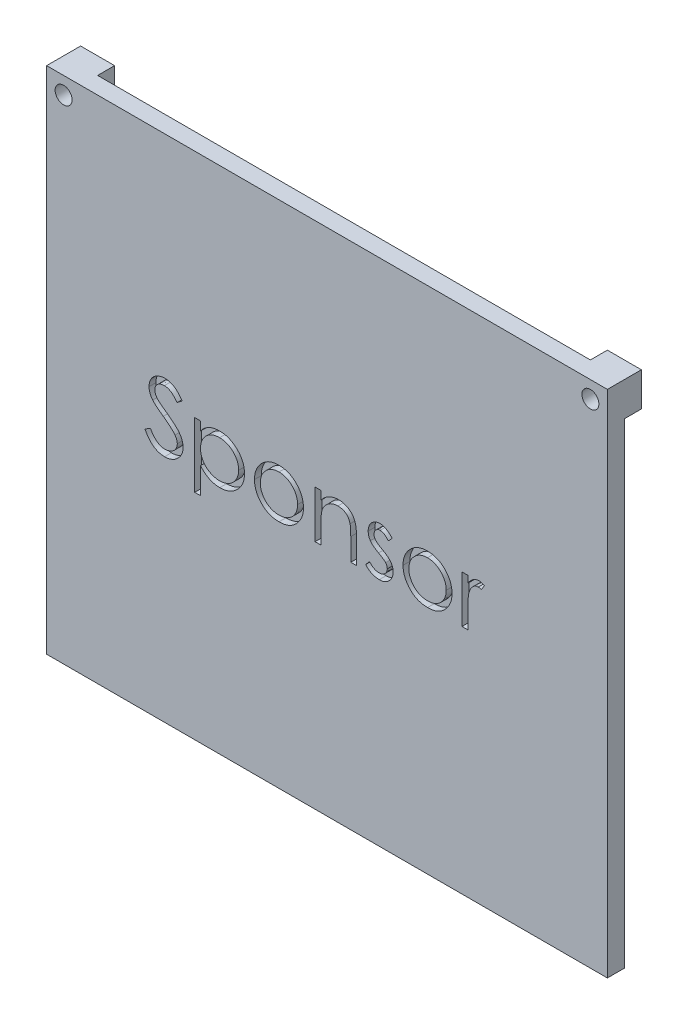
from build123d import *

# Parameters (mm, degrees)
ESQUISSE1_W             = 165
ESQUISSE1_H             = 150
BASE_DEPTH              = 5
ESQUISSE2_W             = 10
ESQUISSE2_H             = 5
BOSS_TIGE_DEPTH         = 10
ESQUISSE3_R             = 2.5
VIDE_VIS_DEPTH          = 112.943065886
ENL_V_MAT_EXTRU_2_DEPTH = 2


with BuildPart() as part:
    # Esquisse1 → BASE (new body)
    with BuildSketch(Plane.XY):
        Rectangle(ESQUISSE1_W, ESQUISSE1_H)
    extrude(amount=BASE_DEPTH)

    # Esquisse2 → BOSS - TIGE (add)
    with BuildSketch(Plane(origin=(0, 75, 0), x_dir=(1, 0, 0), z_dir=(0, 1, 0))):
        with Locations((-77.5, 2.5)):
            Rectangle(ESQUISSE2_W, ESQUISSE2_H)
        with Locations((77.5, 2.5)):
            Rectangle(ESQUISSE2_W, ESQUISSE2_H)
    extrude(amount=-BOSS_TIGE_DEPTH)

    # Esquisse3 → VIDE VIS (cut, through all)
    with BuildSketch(Plane(origin=(0, 0, -5), x_dir=(-1, 0, 0), z_dir=(0, 0, -1))):
        with Locations((-77.5, 70)):
            Circle(ESQUISSE3_R)
        with Locations(Location((77.5, 70, 0), (0, 0, 180))):
            Circle(ESQUISSE3_R)
    extrude(amount=-VIDE_VIS_DEPTH, mode=Mode.SUBTRACT)

    # Esquisse4 → Enlèv. mat.-Extru.2 (cut)
    # profile 1 of 7: a face of its own
    with BuildSketch(Plane.XY.offset(5)):
        with BuildLine():
            Line((-53.580330307, -3.143127408), (-51.969933672, -2.177652648))
            add(Edge.make_bspline(
                [(-51.969933672, -2.177652648), (-51.820155838, -2.428374515), (-51.533187288, -2.908747936), (-51.054480604, -3.557852413), (-50.558457188, -4.109552152), (-50.041443815, -4.560637687), (-49.506596297, -4.915778057), (-48.950423091, -5.167250203), (-48.374798435, -5.324091441), (-47.983055207, -5.343141912), (-47.787481749, -5.352652648)],
                knots=[0, 0, 0, 0, 1.272034388, 2.437168799, 3.508375237, 4.49857839, 5.41946034, 6.295179144, 7.148887113, 8, 8, 8, 8], degree=3))
            add(Edge.make_bspline(
                [(-47.787481749, -5.352652648), (-47.620457551, -5.348000788), (-47.289331686, -5.338778464), (-46.801857192, -5.250164384), (-46.328427669, -5.114026939), (-45.878800655, -4.919058726), (-45.459180239, -4.68317354), (-45.091206654, -4.398260774), (-44.773092809, -4.079275568), (-44.512874629, -3.723407119), (-44.313230437, -3.340680925), (-44.159785036, -2.947837533), (-44.074631135, -2.538705754), (-44.061803662, -2.263240235), (-44.055330307, -2.124227167)],
                knots=[0, 0, 0, 0, 1.095163259, 2.171163733, 3.241058638, 4.321873601, 5.38011039, 6.391990106, 7.366004449, 8.327778327, 9.272591725, 10.192022065, 11.087607919, 12, 12, 12, 12], degree=3))
            add(Edge.make_bspline(
                [(-44.055330307, -2.124227167), (-44.063354769, -1.965617685), (-44.079667329, -1.643187786), (-44.217542956, -1.167483961), (-44.434436714, -0.696717258), (-44.634530532, -0.405517512), (-44.738413239, -0.25433534)],
                knots=[0, 0, 0, 0, 0.938893495, 1.908633276, 2.914225137, 4, 4, 4, 4], degree=3))
            add(Edge.make_bspline(
                [(-44.738413239, -0.25433534), (-44.823706154, -0.145223343), (-45.002767958, 0.083843646), (-45.31060242, 0.424812713), (-45.671823699, 0.776521536), (-46.074070191, 1.152400118), (-46.531994574, 1.534966554), (-47.031254331, 1.942463895), (-47.584596192, 2.359395336), (-47.972669167, 2.639008872), (-48.172908432, 2.783284852)],
                knots=[0, 0, 0, 0, 0.722233717, 1.516239348, 2.393582979, 3.351407094, 4.387010283, 5.505090956, 6.712668013, 8, 8, 8, 8], degree=3))
            add(Edge.make_bspline(
                [(-48.172908432, 2.783284852), (-48.373336182, 2.926043307), (-48.756538779, 3.198986603), (-49.292434777, 3.604067349), (-49.771648212, 3.97442041), (-50.192049144, 4.313532248), (-50.553452664, 4.621448854), (-50.858706659, 4.895213351), (-51.100035091, 5.142229589), (-51.234231894, 5.302474606), (-51.294482951, 5.374420669)],
                knots=[0, 0, 0, 0, 1.452282411, 2.77665338, 3.964542531, 5.026858415, 5.96415736, 6.766646006, 7.446254459, 8, 8, 8, 8], degree=3))
            add(Edge.make_bspline(
                [(-51.294482951, 5.374420669), (-51.378697804, 5.48654917), (-51.544317615, 5.707064915), (-51.762935445, 6.051733069), (-51.948750031, 6.404556842), (-52.094413582, 6.766484334), (-52.217075002, 7.132434446), (-52.299577453, 7.507181941), (-52.351237771, 7.889045279), (-52.356528154, 8.146021618), (-52.35917646, 8.274661054)],
                knots=[0, 0, 0, 0, 1.068054152, 2.10047183, 3.106115577, 4.101338837, 5.06977816, 6.043150881, 7.020423561, 8, 8, 8, 8], degree=3))
            add(Edge.make_bspline(
                [(-52.35917646, 8.274661054), (-52.352072394, 8.476208827), (-52.338016107, 8.874996431), (-52.219141291, 9.457549951), (-52.031510256, 10.013736022), (-51.76864808, 10.538048267), (-51.429790202, 11.016834534), (-51.037654256, 11.455602227), (-50.570594595, 11.824456939), (-50.058135317, 12.146739714), (-49.497214206, 12.398993964), (-48.909435146, 12.589281585), (-48.29386394, 12.697100545), (-47.876924022, 12.712573308), (-47.665366364, 12.720424275)],
                knots=[0, 0, 0, 0, 1.005424448, 1.989358655, 2.955360095, 3.929531133, 4.905563448, 5.876582895, 6.856512386, 7.866279853, 8.892233794, 9.918561126, 10.94386622, 12, 12, 12, 12], degree=3))
            add(Edge.make_bspline(
                [(-47.665366364, 12.720424275), (-47.440880618, 12.71268153), (-46.994450118, 12.697283681), (-46.337773673, 12.563402832), (-45.705527488, 12.34187489), (-45.196929147, 12.090476623), (-44.798877974, 11.839389917), (-44.495314958, 11.610682017), (-44.187698547, 11.347383211), (-43.87354742, 11.048792172), (-43.558184688, 10.712169141), (-43.236928469, 10.339819534), (-42.90902752, 9.934018851), (-42.69808491, 9.644325497), (-42.589945691, 9.4958149)],
                knots=[0, 0, 0, 0, 1.286793592, 2.559021753, 3.825965368, 5.121522368, 5.803751409, 6.523245864, 7.299691795, 8.125521123, 9.008227632, 9.944561021, 10.946284179, 12, 12, 12, 12], degree=3))
            Line((-42.589945691, 9.4958149), (-44.135468528, 8.324270429))
            add(Edge.make_bspline(
                [(-44.135468528, 8.324270429), (-44.228791389, 8.444496015), (-44.408509399, 8.676022385), (-44.681357035, 9.000260546), (-44.938524676, 9.29644167), (-45.191891852, 9.55369901), (-45.428077189, 9.786120621), (-45.657314233, 9.985110155), (-45.876304059, 10.152617324), (-46.152348958, 10.331380129), (-46.499155397, 10.508580527), (-46.934499801, 10.658526223), (-47.389447955, 10.74863306), (-47.699307807, 10.760546863), (-47.856171653, 10.766578121)],
                knots=[0, 0, 0, 0, 1.181633172, 2.275549214, 3.290209073, 4.226197932, 5.078386478, 5.862611352, 6.581680152, 7.217281963, 8.414376989, 9.595101626, 10.782541182, 12, 12, 12, 12], degree=3))
            add(Edge.make_bspline(
                [(-47.856171653, 10.766578121), (-48.052966439, 10.759983011), (-48.432466646, 10.747264963), (-48.971256359, 10.608363329), (-49.456181866, 10.389659204), (-49.872846541, 10.083144823), (-50.219757802, 9.719991991), (-50.470703228, 9.302095652), (-50.621743409, 8.840637146), (-50.640174445, 8.51873756), (-50.649561076, 8.354799275)],
                knots=[0, 0, 0, 0, 1.14458467, 2.207223713, 3.21896685, 4.227309161, 5.202851033, 6.127160689, 7.046193047, 8, 8, 8, 8], degree=3))
            add(Edge.make_bspline(
                [(-50.649561076, 8.354799275), (-50.647421344, 8.252737656), (-50.643138381, 8.048447527), (-50.583404125, 7.746633359), (-50.506663491, 7.44558164), (-50.385055739, 7.146645868), (-50.217169157, 6.844598), (-49.996705271, 6.534236828), (-49.719047102, 6.212826814), (-49.506356506, 6.003780965), (-49.394062278, 5.893411054)],
                knots=[0, 0, 0, 0, 0.858281714, 1.717966888, 2.583508476, 3.4729293, 4.427298488, 5.488583878, 6.674047936, 8, 8, 8, 8], degree=3))
            add(Edge.make_bspline(
                [(-49.394062278, 5.893411054), (-49.352362522, 5.856198099), (-49.253293448, 5.767788636), (-49.072177338, 5.623050652), (-48.833002965, 5.444509848), (-48.542015841, 5.223598883), (-48.19385063, 4.967341211), (-47.788469046, 4.679013407), (-47.330389845, 4.349255409), (-47.005331989, 4.118709366), (-46.833455307, 3.996806486)],
                knots=[0, 0, 0, 0, 0.420754252, 0.999615792, 1.744751191, 2.668019286, 3.750313428, 4.999500688, 6.413464383, 8, 8, 8, 8], degree=3))
            add(Edge.make_bspline(
                [(-46.833455307, 3.996806486), (-46.626703407, 3.846358515), (-46.226357009, 3.555036871), (-45.656720752, 3.117345812), (-45.140227311, 2.689277243), (-44.675063303, 2.273564839), (-44.256633273, 1.873361933), (-43.889579393, 1.483853765), (-43.570161619, 1.107830863), (-43.226286158, 0.625742986), (-42.874907169, 0.033663085), (-42.573146965, -0.691751328), (-42.382873673, -1.419985587), (-42.357991568, -1.909444511), (-42.345714922, -2.150939908)],
                knots=[0, 0, 0, 0, 1.163667725, 2.253281268, 3.268753668, 4.215851969, 5.092017293, 5.902905408, 6.650798638, 7.335211899, 8.59617414, 9.77448103, 10.901945474, 12, 12, 12, 12], degree=3))
            add(Edge.make_bspline(
                [(-42.345714922, -2.150939908), (-42.349291631, -2.321727866), (-42.356375592, -2.659987197), (-42.437805708, -3.156675544), (-42.557111314, -3.639080706), (-42.736928259, -4.101239761), (-42.956401449, -4.551607683), (-43.234892026, -4.978370684), (-43.557695282, -5.390974082), (-43.927993345, -5.778415657), (-44.333191756, -6.134085666), (-44.761455866, -6.450473844), (-45.213486637, -6.714280004), (-45.686831875, -6.929549587), (-46.181600308, -7.097916304), (-46.697625531, -7.219906349), (-47.235758157, -7.294776718), (-47.601520778, -7.30254782), (-47.787481749, -7.306498802)],
                knots=[0, 0, 0, 0, 0.983748083, 1.948392443, 2.894712957, 3.844097841, 4.80183111, 5.778335162, 6.776009319, 7.81870978, 8.863265674, 9.881300176, 10.883814829, 11.87499822, 12.874611388, 13.892143829, 14.928324115, 16, 16, 16, 16], degree=3))
            add(Edge.make_bspline(
                [(-47.787481749, -7.306498802), (-47.931365544, -7.303716514), (-48.217321067, -7.298186977), (-48.640282675, -7.249303151), (-49.054699582, -7.180140201), (-49.455371603, -7.07033562), (-49.847460944, -6.937110931), (-50.22926232, -6.773072292), (-50.60096077, -6.576491524), (-50.964639329, -6.351728604), (-51.31937305, -6.090157166), (-51.661834726, -5.785501421), (-52.003260721, -5.446163744), (-52.33357355, -5.062929106), (-52.659454521, -4.64198897), (-52.974478436, -4.179404986), (-53.28516607, -3.677696817), (-53.480104545, -3.324645422), (-53.580330307, -3.143127408)],
                knots=[0, 0, 0, 0, 0.915332311, 1.819136955, 2.706846663, 3.586547465, 4.459518054, 5.340707479, 6.227863349, 7.133153174, 8.059268498, 9.028702269, 10.047606654, 11.120612155, 12.245963614, 13.433783089, 14.680604001, 16, 16, 16, 16], degree=3))
        make_face()
    # profile 2 of 7: a face of its own
    with BuildSketch(Plane.XY.offset(5)):
        with BuildLine():
            Line((-38.926484153, 7.103116583), (-37.216868768, 7.103116583))
            Line((-37.216868768, 7.103116583), (-37.216868768, 4.527245188))
            add(Edge.make_bspline(
                [(-37.216868768, 4.527245188), (-37.035308748, 4.76094914), (-36.682483182, 5.215106), (-36.074380486, 5.802880842), (-35.432521712, 6.298590709), (-34.740389424, 6.687115639), (-34.008740482, 6.980054629), (-33.24057744, 7.196568492), (-32.429380734, 7.32415709), (-31.874772899, 7.339514989), (-31.591928864, 7.347347352)],
                knots=[0, 0, 0, 0, 1.0828784, 2.104357462, 3.088488658, 4.04616522, 5.001424249, 5.969181776, 6.964304535, 8, 8, 8, 8], degree=3))
            add(Edge.make_bspline(
                [(-31.591928864, 7.347347352), (-31.344868853, 7.340199907), (-30.856541761, 7.326072606), (-30.137740472, 7.23042498), (-29.445543027, 7.066498683), (-28.783865476, 6.830273701), (-28.145619364, 6.538234643), (-27.540253364, 6.169660492), (-26.958338154, 5.742906797), (-26.41450861, 5.25178609), (-25.912016596, 4.720409383), (-25.477425238, 4.148787985), (-25.102565302, 3.555720193), (-24.799559831, 2.932011805), (-24.562205826, 2.282574283), (-24.393397366, 1.604783769), (-24.29293505, 0.901153293), (-24.279456077, 0.422711342), (-24.272637999, 0.180700717)],
                knots=[0, 0, 0, 0, 1.041296284, 2.058176809, 3.050446431, 4.034000596, 5.01514041, 6.003636468, 7.015969324, 8.052561599, 9.08815499, 10.094063707, 11.074456064, 12.040834395, 13.011057502, 13.983766392, 14.980127149, 16, 16, 16, 16], degree=3))
            add(Edge.make_bspline(
                [(-24.272637999, 0.180700717), (-24.279308142, -0.066417562), (-24.292462626, -0.553770471), (-24.394489016, -1.269435957), (-24.557540002, -1.957888663), (-24.791899541, -2.617983484), (-25.094748214, -3.249265929), (-25.463254464, -3.851280741), (-25.898065092, -4.42383504), (-26.395004087, -4.959155825), (-26.934135067, -5.452274942), (-27.510411117, -5.883556435), (-28.114888984, -6.245731635), (-28.744476065, -6.548261744), (-29.40456204, -6.776274917), (-30.092067166, -6.940746089), (-30.806617135, -7.042170987), (-31.292670548, -7.055517648), (-31.538503384, -7.062268033)],
                knots=[0, 0, 0, 0, 1.038740735, 2.04854663, 3.033179607, 4.009277356, 4.987731542, 5.972001279, 6.972200261, 8.005528982, 9.039189865, 10.040446548, 11.026516639, 11.997840187, 12.972163198, 13.956796175, 14.96660207, 16, 16, 16, 16], degree=3))
            add(Edge.make_bspline(
                [(-31.538503384, -7.062268033), (-31.815150597, -7.055220579), (-32.361609949, -7.041299793), (-33.160608698, -6.900224147), (-33.92955842, -6.68938454), (-34.659939909, -6.380780017), (-35.357539003, -5.987503566), (-36.01840966, -5.507932303), (-36.646062272, -4.943069188), (-37.023844223, -4.51454316), (-37.216868768, -4.29559135)],
                knots=[0, 0, 0, 0, 1.014726462, 2.004382257, 2.969841629, 3.936926163, 4.907207904, 5.903978561, 6.929055279, 8, 8, 8, 8], degree=3))
            Line((-37.216868768, -4.29559135), (-37.216868768, -11.946883417))
            Line((-37.216868768, -11.946883417), (-38.926484153, -11.946883417))
            Line((-38.926484153, -11.946883417), (-38.926484153, 7.103116583))
        make_face()
        with BuildLine():
            add(Edge.make_bspline(
                [(-31.607193287, 5.637731967), (-31.800847763, 5.634247133), (-32.182103511, 5.627386393), (-32.740933731, 5.545885329), (-33.279207417, 5.427569909), (-33.791499752, 5.248435138), (-34.282720965, 5.028550169), (-34.749087633, 4.753783794), (-35.190272394, 4.429106448), (-35.60516523, 4.060737447), (-35.979978299, 3.654838073), (-36.311790807, 3.221652998), (-36.590504853, 2.76173081), (-36.821837278, 2.279355622), (-36.997877145, 1.770746285), (-37.122821848, 1.238799458), (-37.201364197, 0.682932909), (-37.211645413, 0.304349502), (-37.216868768, 0.112010813)],
                knots=[0, 0, 0, 0, 1.05670511, 2.080379991, 3.077984906, 4.06214886, 5.038337365, 6.01289324, 7.01187578, 8.025460281, 9.038092164, 10.024533457, 11.000252242, 11.969694649, 12.940728589, 13.933144304, 14.949937299, 16, 16, 16, 16], degree=3))
            add(Edge.make_bspline(
                [(-37.216868768, 0.112010813), (-37.208209966, -0.140473056), (-37.191246638, -0.635110341), (-37.053338964, -1.357835347), (-36.828901313, -2.041739358), (-36.510337885, -2.681063002), (-36.107851803, -3.268798147), (-35.622903266, -3.795071305), (-35.059880238, -4.25657438), (-34.428143094, -4.645310061), (-33.750931212, -4.960930822), (-33.044525033, -5.186886738), (-32.318639039, -5.326072724), (-31.827865756, -5.343744697), (-31.580480547, -5.352652648)],
                knots=[0, 0, 0, 0, 1.03728447, 2.032128127, 3.01272805, 3.987917167, 4.958271349, 5.931593992, 6.91984656, 7.941419022, 8.973179163, 9.983609215, 10.983593296, 12, 12, 12, 12], degree=3))
            add(Edge.make_bspline(
                [(-31.580480547, -5.352652648), (-31.338078724, -5.344181511), (-30.856954684, -5.327367827), (-30.148522623, -5.181835692), (-29.460052148, -4.959522058), (-28.805928638, -4.635347901), (-28.191846511, -4.238073442), (-27.63731977, -3.76149669), (-27.152867855, -3.209101428), (-26.739949008, -2.594012291), (-26.407219067, -1.934471988), (-26.157227332, -1.252039002), (-26.012944955, -0.549118913), (-25.992497292, -0.07560279), (-25.982253384, 0.161620188)],
                knots=[0, 0, 0, 0, 1.00104056, 1.986885549, 2.97790532, 3.984399681, 4.995088187, 5.994304198, 6.996462723, 8.023150851, 9.048424203, 10.043036403, 11.019596776, 12, 12, 12, 12], degree=3))
            add(Edge.make_bspline(
                [(-25.982253384, 0.161620188), (-25.990171292, 0.400316629), (-26.00594542, 0.875849825), (-26.161322869, 1.576687911), (-26.394821319, 2.261878181), (-26.735321301, 2.912411459), (-27.139188211, 3.52622468), (-27.627668294, 4.068082221), (-28.175307878, 4.54253974), (-28.788658899, 4.934509328), (-29.446920357, 5.246306094), (-30.139877257, 5.474272757), (-30.864014578, 5.611289879), (-31.357287955, 5.628840406), (-31.607193287, 5.637731967)],
                knots=[0, 0, 0, 0, 0.983928682, 1.960191568, 2.949917689, 3.96440592, 4.982380491, 5.975291189, 6.965713506, 7.964880129, 8.970154049, 9.96478489, 10.968906225, 12, 12, 12, 12], degree=3))
        make_face(mode=Mode.SUBTRACT)
    # profile 3 of 7: a face of its own
    with BuildSketch(Plane.XY.offset(5)):
        with BuildLine():
            add(Edge.make_bspline(
                [(-14.129428864, 7.347347352), (-13.868219222, 7.341785344), (-13.35605095, 7.330879607), (-12.605982314, 7.214321008), (-11.890000931, 7.036081782), (-11.205364657, 6.789675137), (-10.560841677, 6.459391949), (-9.947043906, 6.065278522), (-9.365654186, 5.59837612), (-9.017185984, 5.237198633), (-8.840306268, 5.053867785)],
                knots=[0, 0, 0, 0, 1.054011418, 2.066658804, 3.057071809, 4.030435133, 4.997543892, 5.974964718, 6.972108034, 8, 8, 8, 8], degree=3))
            add(Edge.make_bspline(
                [(-8.840306268, 5.053867785), (-8.68800449, 4.878531662), (-8.386348391, 4.531252654), (-7.999547836, 3.968158532), (-7.66632763, 3.38501027), (-7.399284943, 2.774064106), (-7.188727885, 2.140653396), (-7.039236024, 1.482601021), (-6.950316421, 0.801360246), (-6.938325987, 0.338696498), (-6.932253384, 0.104378602)],
                knots=[0, 0, 0, 0, 1.025258237, 2.030674902, 3.01204498, 3.988269485, 4.97094183, 5.956517959, 6.965070386, 8, 8, 8, 8], degree=3))
            add(Edge.make_bspline(
                [(-6.932253384, 0.104378602), (-6.937594662, -0.131297426), (-6.948149278, -0.597004249), (-7.047990962, -1.282909654), (-7.203281587, -1.947998618), (-7.425523449, -2.589486651), (-7.710501158, -3.209334612), (-8.058249043, -3.804835158), (-8.471207416, -4.377163198), (-8.939314884, -4.921458918), (-9.456668667, -5.423106458), (-10.017915132, -5.860321754), (-10.612024944, -6.234907479), (-11.246898052, -6.53663997), (-11.916736802, -6.774545625), (-12.622985987, -6.941641428), (-13.364548441, -7.042670022), (-13.870882317, -7.05564347), (-14.129428864, -7.062268033)],
                knots=[0, 0, 0, 0, 0.998656419, 1.973391657, 2.932242238, 3.890759089, 4.846373663, 5.82037756, 6.809684879, 7.83454468, 8.860553229, 9.859544525, 10.845671541, 11.83227036, 12.833544569, 13.85385346, 14.904124723, 16, 16, 16, 16], degree=3))
            add(Edge.make_bspline(
                [(-14.129428864, -7.062268033), (-14.389242123, -7.055621236), (-14.898099517, -7.042603149), (-15.642279504, -6.942033939), (-16.34979443, -6.774622634), (-17.020510088, -6.535858138), (-17.658112755, -6.234897835), (-18.255664974, -5.861454211), (-18.817367371, -5.422976794), (-19.334830601, -4.921494051), (-19.802908724, -4.377154146), (-20.21587467, -3.804837508), (-20.563620588, -3.209333999), (-20.848598812, -2.589486814), (-21.070840536, -1.947998574), (-21.226131198, -1.282909666), (-21.325972871, -0.597004246), (-21.336527489, -0.131297425), (-21.341868768, 0.104378602)],
                knots=[0, 0, 0, 0, 1.099876186, 2.154163076, 3.173186993, 4.173200201, 5.163417411, 6.152872554, 7.150605724, 8.17532212, 9.198891216, 10.186952605, 11.159729845, 12.11414092, 13.071450619, 14.029093627, 15.002601286, 16, 16, 16, 16], degree=3))
            add(Edge.make_bspline(
                [(-21.341868768, 0.104378602), (-21.33575475, 0.337422944), (-21.323650046, 0.798810692), (-21.234819847, 1.478770836), (-21.085911132, 2.135709482), (-20.875101674, 2.766675287), (-20.605597564, 3.374944161), (-20.277059696, 3.959533312), (-19.886313539, 4.520081198), (-19.585857203, 4.866911376), (-19.433815884, 5.042419467)],
                knots=[0, 0, 0, 0, 1.031353054, 2.041901799, 3.029428768, 4.008703097, 4.981709435, 5.96992636, 6.972712378, 8, 8, 8, 8], degree=3))
            add(Edge.make_bspline(
                [(-19.433815884, 5.042419467), (-19.257202838, 5.227340208), (-18.909862208, 5.591019383), (-18.325578418, 6.056560693), (-17.71329062, 6.458875323), (-17.061644951, 6.782595867), (-16.37757111, 7.037531228), (-15.657920661, 7.214780675), (-14.905306784, 7.33045965), (-14.390632275, 7.341662017), (-14.129428864, 7.347347352)],
                knots=[0, 0, 0, 0, 1.027980169, 2.021703884, 2.998553061, 3.971491411, 4.943284454, 5.930300938, 6.949603206, 8, 8, 8, 8], degree=3))
        make_face()
        with BuildLine():
            add(Edge.make_bspline(
                [(-14.137061076, 5.637731967), (-14.321778646, 5.632481833), (-14.686445332, 5.622117095), (-15.223217643, 5.54328327), (-15.739963338, 5.418383284), (-16.23766279, 5.240924063), (-16.714637628, 5.011785771), (-17.171344518, 4.730344553), (-17.609126798, 4.400328033), (-18.019420601, 4.022252635), (-18.395970042, 3.609254107), (-18.725143029, 3.169208039), (-19.005042537, 2.709252069), (-19.238215402, 2.228907891), (-19.411881669, 1.723307753), (-19.53800912, 1.19817746), (-19.616768571, 0.652447122), (-19.62703586, 0.281456436), (-19.632253384, 0.092930285)],
                knots=[0, 0, 0, 0, 1.021534396, 2.016698045, 2.994645724, 3.958388632, 4.93408049, 5.916473867, 6.921342795, 7.962252576, 8.998418191, 10.008913653, 10.997312074, 11.973003931, 12.956656626, 13.948281152, 14.957379055, 16, 16, 16, 16], degree=3))
            add(Edge.make_bspline(
                [(-19.632253384, 0.092930285), (-19.623507672, -0.150648606), (-19.60614907, -0.634107156), (-19.464987283, -1.346093409), (-19.22884196, -2.02961749), (-18.909959766, -2.680672391), (-18.510420204, -3.28304579), (-18.039683456, -3.820100584), (-17.502801658, -4.283754786), (-16.906174707, -4.668460531), (-16.261989062, -4.974130059), (-15.5802368, -5.190750198), (-14.869178166, -5.331566124), (-14.3832359, -5.345562291), (-14.137061076, -5.352652648)],
                knots=[0, 0, 0, 0, 1.016792936, 2.018143844, 3.017858371, 4.030088057, 5.03801393, 6.028138512, 7.003788237, 7.991172063, 8.984598303, 9.972568034, 10.972917682, 12, 12, 12, 12], degree=3))
            add(Edge.make_bspline(
                [(-14.137061076, -5.352652648), (-13.890900411, -5.34552098), (-13.404986095, -5.331443265), (-12.694915433, -5.191459403), (-12.015026529, -4.973180907), (-11.371509977, -4.668804307), (-10.775154607, -4.282293878), (-10.234411532, -3.82271874), (-9.767694092, -3.281623349), (-9.368549756, -2.679874514), (-9.044445342, -2.030626826), (-8.809405344, -1.345967256), (-8.667904198, -0.634139285), (-8.650591402, -0.15065937), (-8.641868768, 0.092930285)],
                knots=[0, 0, 0, 0, 1.02726834, 2.027799167, 3.010890988, 4.004497153, 4.992059811, 5.971914811, 6.958719428, 7.966827853, 8.981595046, 9.981490638, 10.983022906, 12, 12, 12, 12], degree=3))
            add(Edge.make_bspline(
                [(-8.641868768, 0.092930285), (-8.647084495, 0.281457563), (-8.657348249, 0.652450465), (-8.736133413, 1.198164677), (-8.862165707, 1.723354653), (-9.036182652, 2.228734842), (-9.268342356, 2.710495759), (-9.553639473, 3.167857559), (-9.88146834, 3.610778474), (-10.262561526, 4.020917576), (-10.672427055, 4.400475418), (-11.110386762, 4.730472523), (-11.566416431, 5.010548864), (-12.042005574, 5.242883974), (-12.539768835, 5.416768783), (-13.055790496, 5.544004449), (-13.59027259, 5.621783948), (-13.953632525, 5.63238196), (-14.137061076, 5.637731967)],
                knots=[0, 0, 0, 0, 1.042956736, 2.052379634, 3.044323526, 4.02829302, 5.004299113, 5.996692471, 7.007513377, 8.048758398, 9.090003419, 10.095195979, 11.07790575, 12.047570684, 13.018257071, 13.989683339, 14.985167495, 16, 16, 16, 16], degree=3))
        make_face(mode=Mode.SUBTRACT)
    # profile 4 of 7: a face of its own
    with BuildSketch(Plane.XY.offset(5)):
        with BuildLine():
            Line((-3.513022614, 7.103116583), (-1.80340723, 7.103116583))
            Line((-1.80340723, 7.103116583), (-1.80340723, 4.592118986))
            add(Edge.make_bspline(
                [(-1.80340723, 4.592118986), (-1.620866673, 4.819862949), (-1.266640354, 5.261808055), (-0.676719911, 5.842672896), (-0.053273825, 6.321346193), (0.599879937, 6.702911128), (1.283628035, 6.990547765), (1.993802618, 7.198279476), (2.734655519, 7.322838328), (3.238470525, 7.339113724), (3.493347578, 7.347347352)],
                knots=[0, 0, 0, 0, 1.12780773, 2.188550248, 3.19190651, 4.159438251, 5.104880172, 6.052711206, 7.014878035, 8, 8, 8, 8], degree=3))
            add(Edge.make_bspline(
                [(3.493347578, 7.347347352), (3.750961458, 7.337848502), (4.255173961, 7.319256963), (4.989295981, 7.172208973), (5.674951167, 6.921046941), (6.309694749, 6.576992672), (6.881887153, 6.149148867), (7.38439813, 5.650704083), (7.800032377, 5.07737483), (8.07869231, 4.545481651), (8.262256192, 4.073646928), (8.377820772, 3.669532474), (8.475960828, 3.219309394), (8.561042199, 2.724338202), (8.618611908, 2.18115091), (8.664017809, 1.591974186), (8.696558988, 0.956998876), (8.697850072, 0.517833089), (8.698515847, 0.291367785)],
                knots=[0, 0, 0, 0, 1.235846778, 2.418850247, 3.575807741, 4.728682307, 5.871620074, 6.994088408, 8.11269785, 9.256955736, 9.865816715, 10.540099792, 11.271859618, 12.076849838, 12.949306005, 13.892391288, 14.913166135, 16, 16, 16, 16], degree=3))
            Line((8.698515847, 0.291367785), (8.698515847, -6.818037264))
            Line((8.698515847, -6.818037264), (6.988900463, -6.818037264))
            Line((6.988900463, -6.818037264), (6.988900463, -0.269599764))
            add(Edge.make_bspline(
                [(6.988900463, -0.269599764), (6.987848859, -0.08006617), (6.98583732, 0.282479337), (6.979492872, 0.801559306), (6.964199496, 1.272293397), (6.942709393, 1.693556211), (6.911254955, 2.064943236), (6.878474633, 2.38721087), (6.838388116, 2.659949951), (6.802667118, 2.824134186), (6.786646857, 2.897768025)],
                knots=[0, 0, 0, 0, 1.430800155, 2.736877192, 3.918605307, 4.986035426, 5.920637409, 6.731861385, 7.431261377, 8, 8, 8, 8], degree=3))
            add(Edge.make_bspline(
                [(6.786646857, 2.897768025), (6.728813607, 3.113910332), (6.617502494, 3.529917399), (6.342453243, 4.094202089), (5.995121773, 4.574252226), (5.571134907, 4.967099811), (5.074588081, 5.272829651), (4.506859204, 5.484959319), (3.873426888, 5.617635869), (3.427905177, 5.630846402), (3.195691328, 5.637731967)],
                knots=[0, 0, 0, 0, 1.084156227, 2.086665306, 3.027808233, 3.945421172, 4.874247719, 5.839848303, 6.874090471, 8, 8, 8, 8], degree=3))
            add(Edge.make_bspline(
                [(3.195691328, 5.637731967), (3.058162936, 5.635141142), (2.785997801, 5.630013965), (2.382410097, 5.5785719), (1.990937097, 5.494433735), (1.60764996, 5.380848722), (1.240214682, 5.224844085), (0.876826183, 5.04779137), (0.531167938, 4.827093245), (0.195869448, 4.581127148), (-0.116075976, 4.308553178), (-0.406334504, 4.020928058), (-0.665077157, 3.714627986), (-0.899493804, 3.394588272), (-1.10184978, 3.056413554), (-1.278487302, 2.7033664), (-1.428360156, 2.334982133), (-1.502833096, 2.079303585), (-1.540095932, 1.951373794)],
                knots=[0, 0, 0, 0, 1.023777757, 2.026029729, 3.023749952, 4.003683103, 4.997618607, 5.993177895, 7.010360494, 8.046726602, 9.087585522, 10.09234134, 11.086953743, 12.070360549, 13.043493632, 14.017870808, 15.008233677, 16, 16, 16, 16], degree=3))
            add(Edge.make_bspline(
                [(-1.540095932, 1.951373794), (-1.561538876, 1.857456189), (-1.608219044, 1.653002475), (-1.658637209, 1.317480707), (-1.704398441, 0.9293507), (-1.742699601, 0.489065375), (-1.766133368, -0.004916774), (-1.791684299, -0.55048612), (-1.800986474, -1.149818107), (-1.802577715, -1.567076748), (-1.80340723, -1.784593754)],
                knots=[0, 0, 0, 0, 0.615963638, 1.340920617, 2.168419149, 3.115676021, 4.16674242, 5.331190069, 6.6087489, 8, 8, 8, 8], degree=3))
            Line((-1.80340723, -1.784593754), (-1.80340723, -6.818037264))
            Line((-1.80340723, -6.818037264), (-3.513022614, -6.818037264))
            Line((-3.513022614, -6.818037264), (-3.513022614, 7.103116583))
        make_face()
    # profile 5 of 7: a face of its own
    with BuildSketch(Plane.XY.offset(5)):
        with BuildLine():
            Line((19.200438924, 5.366788458), (18.04034277, 4.172347352))
            add(Edge.make_bspline(
                [(18.04034277, 4.172347352), (17.940245887, 4.288351763), (17.747270879, 4.51199461), (17.441210961, 4.811009215), (17.13628249, 5.062125983), (16.836659662, 5.274137563), (16.534808226, 5.434425061), (16.234270429, 5.551418524), (15.934735095, 5.623818352), (15.734513961, 5.633149797), (15.636196136, 5.637731967)],
                knots=[0, 0, 0, 0, 1.26578478, 2.440284043, 3.530471711, 4.527705817, 5.468200915, 6.346673037, 7.188140097, 8, 8, 8, 8], degree=3))
            add(Edge.make_bspline(
                [(15.636196136, 5.637731967), (15.5156946, 5.631881587), (15.27856463, 5.620368867), (14.938789819, 5.505451482), (14.623372846, 5.329055348), (14.350375569, 5.078854915), (14.119121196, 4.791666538), (13.950318161, 4.470557969), (13.847089022, 4.125219331), (13.834000409, 3.885571106), (13.827362001, 3.764024035)],
                knots=[0, 0, 0, 0, 0.99966794, 1.967205029, 2.953328237, 3.988086729, 5.028030931, 6.008226631, 6.989793394, 8, 8, 8, 8], degree=3))
            add(Edge.make_bspline(
                [(13.827362001, 3.764024035), (13.833407994, 3.654012766), (13.845482935, 3.434300348), (13.939354146, 3.110188907), (14.088848053, 2.794192742), (14.228567253, 2.600628923), (14.300559116, 2.500893025)],
                knots=[0, 0, 0, 0, 0.960159726, 1.917612774, 2.927026955, 4, 4, 4, 4], degree=3))
            add(Edge.make_bspline(
                [(14.300559116, 2.500893025), (14.343903275, 2.44763693), (14.436155855, 2.334288045), (14.609285058, 2.1769685), (14.805350395, 2.003111391), (15.041134627, 1.82928375), (15.306479508, 1.646231074), (15.60713904, 1.461162321), (15.933571703, 1.259970237), (16.167273329, 1.132365524), (16.288750222, 1.066037256)],
                knots=[0, 0, 0, 0, 0.66740084, 1.420478572, 2.27185888, 3.217733974, 4.268547843, 5.408967954, 6.65319498, 8, 8, 8, 8], degree=3))
            add(Edge.make_bspline(
                [(16.288750222, 1.066037256), (16.436869835, 0.983061428), (16.722988153, 0.82277945), (17.129530215, 0.573988064), (17.498485395, 0.326711311), (17.832979815, 0.083593721), (18.126577374, -0.162166887), (18.388185868, -0.401150536), (18.611280113, -0.640578057), (18.736215057, -0.807854004), (18.795931713, -0.887808898)],
                knots=[0, 0, 0, 0, 1.27191281, 2.456916733, 3.569705269, 4.599008579, 5.553216877, 6.436649441, 7.252746552, 8, 8, 8, 8], degree=3))
            add(Edge.make_bspline(
                [(18.795931713, -0.887808898), (18.895049012, -1.049277177), (19.092310833, -1.370629021), (19.29945654, -1.899775033), (19.419527465, -2.460990768), (19.436194692, -2.844887566), (19.444669693, -3.040092552)],
                knots=[0, 0, 0, 0, 0.995354457, 1.980940102, 2.973342416, 4, 4, 4, 4], degree=3))
            add(Edge.make_bspline(
                [(19.444669693, -3.040092552), (19.440753374, -3.177628905), (19.433035838, -3.448659314), (19.379379788, -3.847810315), (19.287096274, -4.229542693), (19.16140027, -4.597998457), (18.991668183, -4.946117828), (18.792743744, -5.282683697), (18.553938868, -5.600415549), (18.281298666, -5.898896175), (17.982782477, -6.171505744), (17.664341924, -6.411121835), (17.325584861, -6.610190728), (16.968931841, -6.774920678), (16.593572524, -6.905920768), (16.199448221, -6.996612545), (15.787811714, -7.050892859), (15.507886616, -7.058428365), (15.365252626, -7.062268033)],
                knots=[0, 0, 0, 0, 1.032770009, 2.035186124, 3.017557409, 3.978232242, 4.952395191, 5.920591857, 6.910227898, 7.931268572, 8.952309245, 9.941945286, 10.918353717, 11.897095711, 12.887975737, 13.898235213, 14.929059601, 16, 16, 16, 16], degree=3))
            add(Edge.make_bspline(
                [(15.365252626, -7.062268033), (15.172754143, -7.056864907), (14.790431926, -7.046133731), (14.224975026, -6.945407883), (13.67241204, -6.788678668), (13.136924484, -6.572510512), (12.630487779, -6.299547346), (12.167132318, -5.972636318), (11.745248501, -5.602576475), (11.505119039, -5.318933347), (11.385054309, -5.177111783)],
                knots=[0, 0, 0, 0, 1.013940152, 2.01379169, 3.017749504, 4.037548394, 5.051665909, 6.043208538, 7.021604269, 8, 8, 8, 8], degree=3))
            Line((11.385054309, -5.177111783), (12.518437722, -3.887268033))
            add(Edge.make_bspline(
                [(12.518437722, -3.887268033), (12.626056141, -4.003498965), (12.834690719, -4.228830203), (13.168344485, -4.528864114), (13.507866654, -4.780331033), (13.849866876, -4.990661619), (14.199407676, -5.152724885), (14.554530233, -5.266581803), (14.914512227, -5.339756621), (15.156295566, -5.348346986), (15.277482193, -5.352652648)],
                knots=[0, 0, 0, 0, 1.179806542, 2.287233372, 3.337373186, 4.324005949, 5.273901747, 6.200048787, 7.097828587, 8, 8, 8, 8], degree=3))
            add(Edge.make_bspline(
                [(15.277482193, -5.352652648), (15.442498333, -5.345191444), (15.76491219, -5.330613503), (16.226704647, -5.198259045), (16.6530906, -4.990723165), (17.023331952, -4.696347879), (17.338485143, -4.353689691), (17.566694206, -3.96771427), (17.709711676, -3.549749342), (17.726508325, -3.260013523), (17.735054309, -3.112598562)],
                knots=[0, 0, 0, 0, 1.072336372, 2.095165389, 3.102688358, 4.141489647, 5.156069229, 6.117746104, 7.042326257, 8, 8, 8, 8], degree=3))
            add(Edge.make_bspline(
                [(17.735054309, -3.112598562), (17.729141764, -2.991170494), (17.717468235, -2.75142703), (17.625792712, -2.404443031), (17.480942759, -2.075317375), (17.338314602, -1.88269658), (17.265673299, -1.784593754)],
                knots=[0, 0, 0, 0, 1.013901739, 2.00181326, 2.98231254, 4, 4, 4, 4], degree=3))
            add(Edge.make_bspline(
                [(17.265673299, -1.784593754), (17.222008552, -1.735415568), (17.126890964, -1.628287719), (16.952418865, -1.473574076), (16.743511872, -1.306815279), (16.497820414, -1.130839059), (16.214849199, -0.94796665), (15.89345134, -0.759157462), (15.538029762, -0.555443697), (15.286729611, -0.420353859), (15.155366809, -0.349737985)],
                knots=[0, 0, 0, 0, 0.615000592, 1.339693406, 2.178160186, 3.116406724, 4.166410947, 5.330106347, 6.604359322, 8, 8, 8, 8], degree=3))
            add(Edge.make_bspline(
                [(15.155366809, -0.349737985), (15.013598668, -0.270603568), (14.738664999, -0.117136679), (14.349243316, 0.121892272), (13.997921288, 0.365009867), (13.676245304, 0.59857832), (13.392340401, 0.834912315), (13.147325025, 1.074274213), (12.931552665, 1.307010708), (12.812096038, 1.471914565), (12.75503628, 1.550682688)],
                knots=[0, 0, 0, 0, 1.262093308, 2.447601706, 3.550203992, 4.582594899, 5.537233252, 6.418365656, 7.244515135, 8, 8, 8, 8], degree=3))
            add(Edge.make_bspline(
                [(12.75503628, 1.550682688), (12.656354016, 1.709318107), (12.458955003, 2.026644382), (12.267283748, 2.556291405), (12.135533791, 3.113885217), (12.12376421, 3.498623667), (12.117746616, 3.695334131)],
                knots=[0, 0, 0, 0, 0.985009483, 1.970363186, 2.962279964, 4, 4, 4, 4], degree=3))
            add(Edge.make_bspline(
                [(12.117746616, 3.695334131), (12.120654165, 3.823923797), (12.12634465, 4.075591991), (12.171760131, 4.445373285), (12.254446445, 4.796699665), (12.358159666, 5.134847305), (12.502302876, 5.453265845), (12.674547017, 5.756201509), (12.876952858, 6.043235577), (13.11014277, 6.309952625), (13.366537511, 6.552210529), (13.643550472, 6.763385919), (13.934951554, 6.943579078), (14.241974523, 7.094700881), (14.567568812, 7.209008406), (14.909458543, 7.287697888), (15.266951686, 7.340249777), (15.5113421, 7.344947422), (15.636196136, 7.347347352)],
                knots=[0, 0, 0, 0, 1.087655834, 2.128696564, 3.144119009, 4.137814668, 5.115653402, 6.093965665, 7.082169637, 8.081268856, 9.086088321, 10.061021666, 11.022561449, 11.980240094, 12.950172527, 13.934149372, 14.944599409, 16, 16, 16, 16], degree=3))
            add(Edge.make_bspline(
                [(15.636196136, 7.347347352), (15.784198653, 7.341336583), (16.08298006, 7.32920229), (16.531224524, 7.232832746), (16.978808858, 7.074265422), (17.426883091, 6.855265352), (17.872164809, 6.571872784), (18.318570843, 6.229357598), (18.771460265, 5.82997318), (19.054251055, 5.524633111), (19.200438924, 5.366788458)],
                knots=[0, 0, 0, 0, 0.845714091, 1.707292901, 2.609013841, 3.555613372, 4.552488639, 5.621697636, 6.770543573, 8, 8, 8, 8], degree=3))
        make_face()
    # profile 6 of 7: a face of its own
    with BuildSketch(Plane.XY.offset(5)):
        with BuildLine():
            add(Edge.make_bspline(
                [(29.587878828, 7.347347352), (29.84908847, 7.341785344), (30.361256742, 7.330879607), (31.111325378, 7.214321008), (31.827306761, 7.036081782), (32.511943035, 6.789675137), (33.156466015, 6.459391949), (33.770263786, 6.065278522), (34.351653506, 5.59837612), (34.700121708, 5.237198633), (34.877001424, 5.053867785)],
                knots=[0, 0, 0, 0, 1.054011418, 2.066658804, 3.057071809, 4.030435133, 4.997543892, 5.974964718, 6.972108034, 8, 8, 8, 8], degree=3))
            add(Edge.make_bspline(
                [(34.877001424, 5.053867785), (35.029303203, 4.878531662), (35.330959301, 4.531252654), (35.717759856, 3.968158532), (36.050980062, 3.38501027), (36.31802275, 2.774064106), (36.528579807, 2.140653396), (36.678071668, 1.482601021), (36.766991271, 0.801360246), (36.778981706, 0.338696498), (36.785054309, 0.104378602)],
                knots=[0, 0, 0, 0, 1.025258237, 2.030674902, 3.01204498, 3.988269485, 4.97094183, 5.956517959, 6.965070386, 8, 8, 8, 8], degree=3))
            add(Edge.make_bspline(
                [(36.785054309, 0.104378602), (36.77971303, -0.131297426), (36.769158414, -0.597004249), (36.66931673, -1.282909654), (36.514026106, -1.947998618), (36.291784244, -2.589486651), (36.006806535, -3.209334612), (35.65905865, -3.804835158), (35.246100276, -4.377163198), (34.777992808, -4.921458918), (34.260639025, -5.423106458), (33.699392561, -5.860321754), (33.105282749, -6.234907479), (32.47040964, -6.53663997), (31.80057089, -6.774545625), (31.094321705, -6.941641428), (30.352759251, -7.042670022), (29.846425375, -7.05564347), (29.587878828, -7.062268033)],
                knots=[0, 0, 0, 0, 0.998656419, 1.973391657, 2.932242238, 3.890759089, 4.846373663, 5.82037756, 6.809684879, 7.83454468, 8.860553229, 9.859544525, 10.845671541, 11.83227036, 12.833544569, 13.85385346, 14.904124723, 16, 16, 16, 16], degree=3))
            add(Edge.make_bspline(
                [(29.587878828, -7.062268033), (29.328065569, -7.055621236), (28.819208175, -7.042603149), (28.075028188, -6.942033939), (27.367513262, -6.774622634), (26.696797604, -6.535858138), (26.059194937, -6.234897835), (25.461642718, -5.861454211), (24.899940321, -5.422976794), (24.382477092, -4.921494051), (23.914398968, -4.377154146), (23.501433023, -3.804837508), (23.153687105, -3.209333999), (22.868708881, -2.589486814), (22.646467156, -1.947998574), (22.491176495, -1.282909666), (22.391334821, -0.597004246), (22.380780204, -0.131297425), (22.375438924, 0.104378602)],
                knots=[0, 0, 0, 0, 1.099876186, 2.154163076, 3.173186993, 4.173200201, 5.163417411, 6.152872554, 7.150605724, 8.17532212, 9.198891216, 10.186952605, 11.159729845, 12.11414092, 13.071450619, 14.029093627, 15.002601286, 16, 16, 16, 16], degree=3))
            add(Edge.make_bspline(
                [(22.375438924, 0.104378602), (22.381552942, 0.337422944), (22.393657646, 0.798810692), (22.482487846, 1.478770836), (22.63139656, 2.135709482), (22.842206018, 2.766675287), (23.111710129, 3.374944161), (23.440247996, 3.959533312), (23.830994153, 4.520081198), (24.131450489, 4.866911376), (24.283491809, 5.042419467)],
                knots=[0, 0, 0, 0, 1.031353054, 2.041901799, 3.029428768, 4.008703097, 4.981709435, 5.96992636, 6.972712378, 8, 8, 8, 8], degree=3))
            add(Edge.make_bspline(
                [(24.283491809, 5.042419467), (24.460104854, 5.227340208), (24.807445485, 5.591019383), (25.391729274, 6.056560693), (26.004017072, 6.458875323), (26.655662741, 6.782595867), (27.339736582, 7.037531228), (28.059387031, 7.214780675), (28.812000908, 7.33045965), (29.326675417, 7.341662017), (29.587878828, 7.347347352)],
                knots=[0, 0, 0, 0, 1.027980169, 2.021703884, 2.998553061, 3.971491411, 4.943284454, 5.930300938, 6.949603206, 8, 8, 8, 8], degree=3))
        make_face()
        with BuildLine():
            add(Edge.make_bspline(
                [(29.580246616, 5.637731967), (29.395529046, 5.632481833), (29.03086236, 5.622117095), (28.494090049, 5.54328327), (27.977344354, 5.418383284), (27.479644903, 5.240924063), (27.002670064, 5.011785771), (26.545963174, 4.730344553), (26.108180894, 4.400328033), (25.697887092, 4.022252635), (25.32133765, 3.609254107), (24.992164663, 3.169208039), (24.712265155, 2.709252069), (24.47909229, 2.228907891), (24.305426024, 1.723307753), (24.179298573, 1.19817746), (24.100539121, 0.652447122), (24.090271832, 0.281456436), (24.085054309, 0.092930285)],
                knots=[0, 0, 0, 0, 1.021534396, 2.016698045, 2.994645724, 3.958388632, 4.93408049, 5.916473867, 6.921342795, 7.962252576, 8.998418191, 10.008913653, 10.997312074, 11.973003931, 12.956656626, 13.948281152, 14.957379055, 16, 16, 16, 16], degree=3))
            add(Edge.make_bspline(
                [(24.085054309, 0.092930285), (24.09380002, -0.150648606), (24.111158622, -0.634107156), (24.252320409, -1.346093409), (24.488465732, -2.02961749), (24.807347926, -2.680672391), (25.206887488, -3.28304579), (25.677624237, -3.820100584), (26.214506034, -4.283754786), (26.811132985, -4.668460531), (27.45531863, -4.974130059), (28.137070892, -5.190750198), (28.848129527, -5.331566124), (29.334071792, -5.345562291), (29.580246616, -5.352652648)],
                knots=[0, 0, 0, 0, 1.016792936, 2.018143844, 3.017858371, 4.030088057, 5.03801393, 6.028138512, 7.003788237, 7.991172063, 8.984598303, 9.972568034, 10.972917682, 12, 12, 12, 12], degree=3))
            add(Edge.make_bspline(
                [(29.580246616, -5.352652648), (29.826407282, -5.34552098), (30.312321597, -5.331443265), (31.022392259, -5.191459403), (31.702281163, -4.973180907), (32.345797715, -4.668804307), (32.942153086, -4.282293878), (33.48289616, -3.82271874), (33.949613601, -3.281623349), (34.348757936, -2.679874514), (34.67286235, -2.030626826), (34.907902348, -1.345967256), (35.049403494, -0.634139285), (35.066716291, -0.15065937), (35.075438924, 0.092930285)],
                knots=[0, 0, 0, 0, 1.02726834, 2.027799167, 3.010890988, 4.004497153, 4.992059811, 5.971914811, 6.958719428, 7.966827853, 8.981595046, 9.981490638, 10.983022906, 12, 12, 12, 12], degree=3))
            add(Edge.make_bspline(
                [(35.075438924, 0.092930285), (35.070223197, 0.281457563), (35.059959443, 0.652450465), (34.98117428, 1.198164677), (34.855141985, 1.723354653), (34.68112504, 2.228734842), (34.448965336, 2.710495759), (34.163668219, 3.167857559), (33.835839353, 3.610778474), (33.454746166, 4.020917576), (33.044880638, 4.400475418), (32.60692093, 4.730472523), (32.150891261, 5.010548864), (31.675302118, 5.242883974), (31.177538857, 5.416768783), (30.661517197, 5.544004449), (30.127035103, 5.621783948), (29.763675168, 5.63238196), (29.580246616, 5.637731967)],
                knots=[0, 0, 0, 0, 1.042956736, 2.052379634, 3.044323526, 4.02829302, 5.004299113, 5.996692471, 7.007513377, 8.048758398, 9.090003419, 10.095195979, 11.07790575, 12.047570684, 13.018257071, 13.989683339, 14.985167495, 16, 16, 16, 16], degree=3))
        make_face(mode=Mode.SUBTRACT)
    # profile 7 of 7: a face of its own
    with BuildSketch(Plane.XY.offset(5)):
        with BuildLine():
            Line((39.71582354, 7.103116583), (41.425438924, 7.103116583))
            Line((41.425438924, 7.103116583), (41.425438924, 5.053867785))
            add(Edge.make_bspline(
                [(41.425438924, 5.053867785), (41.551652025, 5.24467165), (41.793033601, 5.609582561), (42.194242545, 6.092196899), (42.605196391, 6.49178451), (43.027862482, 6.810210805), (43.465348997, 7.048679351), (43.908054405, 7.223357156), (44.362943749, 7.326647972), (44.668625079, 7.340438316), (44.821773059, 7.347347352)],
                knots=[0, 0, 0, 0, 1.2804753, 2.448899062, 3.506932113, 4.484331642, 5.4025378, 6.288909075, 7.142734305, 8, 8, 8, 8], degree=3))
            add(Edge.make_bspline(
                [(44.821773059, 7.347347352), (44.940570636, 7.340867486), (45.185004371, 7.32753474), (45.555023895, 7.23385868), (45.936260398, 7.084299729), (46.181963963, 6.943655088), (46.310054309, 6.870334131)],
                knots=[0, 0, 0, 0, 0.901110191, 1.854092781, 2.881294221, 4, 4, 4, 4], degree=3))
            Line((46.310054309, 6.870334131), (45.37129229, 5.389685092))
            add(Edge.make_bspline(
                [(45.37129229, 5.389685092), (45.289056046, 5.426371398), (45.132955913, 5.496009029), (44.904603202, 5.578424827), (44.694066212, 5.626952883), (44.559934844, 5.634304645), (44.497404068, 5.637731967)],
                knots=[0, 0, 0, 0, 1.180555205, 2.24091978, 3.179933427, 4, 4, 4, 4], degree=3))
            add(Edge.make_bspline(
                [(44.497404068, 5.637731967), (44.360212862, 5.628587764), (44.080382568, 5.60993624), (43.669531221, 5.463312157), (43.270857145, 5.226410493), (42.954237097, 4.963677727), (42.70907855, 4.710324715), (42.534143894, 4.489081267), (42.373673514, 4.241003287), (42.220347028, 3.970331722), (42.080649056, 3.672444989), (41.950267213, 3.350319213), (41.832381116, 3.003581298), (41.765160501, 2.762013581), (41.730727386, 2.638272833)],
                knots=[0, 0, 0, 0, 1.125678352, 2.296057538, 3.5422874, 4.923748041, 5.663163013, 6.437101912, 7.23742474, 8.08941207, 8.991984279, 9.93940061, 10.944477711, 12, 12, 12, 12], degree=3))
            add(Edge.make_bspline(
                [(41.730727386, 2.638272833), (41.704969645, 2.527907074), (41.647918206, 2.283455304), (41.592447121, 1.873344048), (41.537640173, 1.388800991), (41.499014293, 0.828477392), (41.46321095, 0.193772519), (41.443017502, -0.516280556), (41.426127551, -1.302410653), (41.42567543, -1.851999633), (41.425438924, -2.13949159)],
                knots=[0, 0, 0, 0, 0.566838948, 1.255505196, 2.06880316, 3.007127437, 4.065329342, 5.249902469, 6.561414163, 8, 8, 8, 8], degree=3))
            Line((41.425438924, -2.13949159), (41.425438924, -6.818037264))
            Line((41.425438924, -6.818037264), (39.71582354, -6.818037264))
            Line((39.71582354, -6.818037264), (39.71582354, 7.103116583))
        make_face()
    extrude(amount=-ENL_V_MAT_EXTRU_2_DEPTH, mode=Mode.SUBTRACT)


solid = part.part
